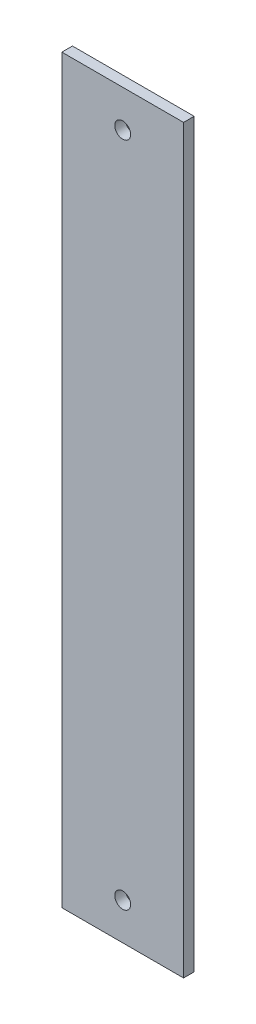
from build123d import *

# Parameters (mm, degrees)
SKETCH2_W           = 23
SKETCH2_H           = 140
SKETCH2_R           = 1.5
BOSS_EXTRUDE1_DEPTH = 2


with BuildPart() as part:
    # Sketch2 → Boss-Extrude1 (new body)
    with BuildSketch(Plane.XY):
        with Locations((11.5, 70)):
            Rectangle(SKETCH2_W, SKETCH2_H)
        with Locations((11.5, 133)):
            Circle(SKETCH2_R, mode=Mode.SUBTRACT)
        with Locations((11.5, 7)):
            Circle(SKETCH2_R, mode=Mode.SUBTRACT)
    extrude(amount=BOSS_EXTRUDE1_DEPTH)


solid = part.part
